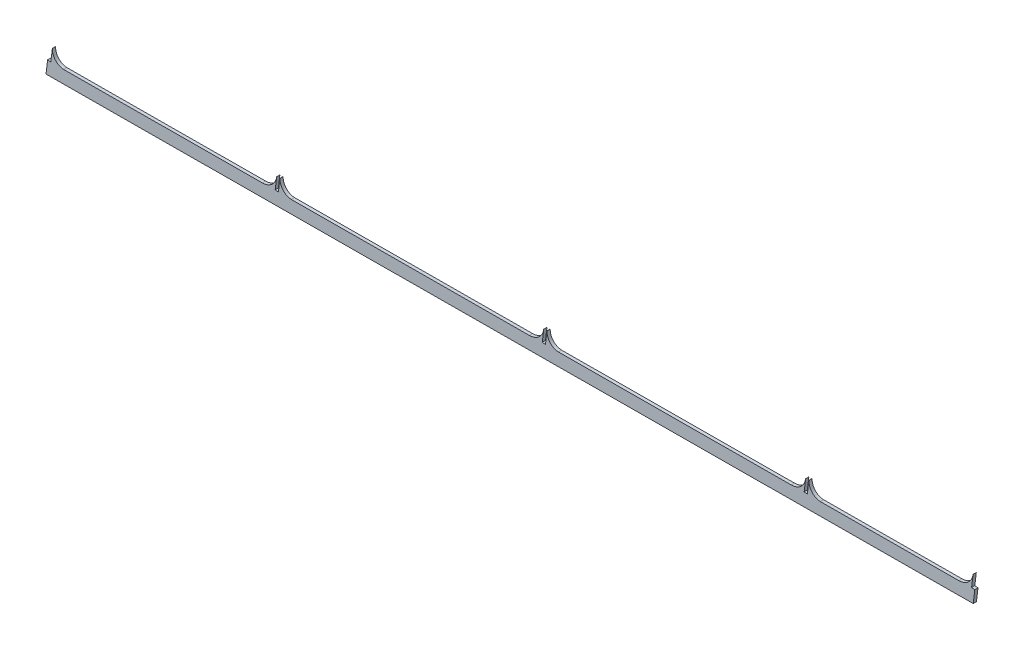
from build123d import *

# Parameters (mm, degrees)
EXTRUDE_1_DEPTH = 2


with BuildPart() as part:
    # Model → 凸台-拉伸1 (new body)
    with BuildSketch(Plane.XY):
        with BuildLine():
            Line((5.143788589, 18.04241923), (4.137613793, 9.847783121))
            Line((4.137613793, 9.847783121), (580.873096163, 12.99559552))
            Line((580.873096163, 12.99559552), (581.848050911, 20.935964733))
            Line((581.848050911, 20.935964733), (579.866676478, 21.179246923))
            Line((579.866676478, 21.179246923), (580.791756024, 28.713415216))
            ThreePointArc((580.791756024, 28.713415216), (577.819958349, 23.132995179), (571.91207976, 20.881409119))
            Line((571.91207976, 20.881409119), (485.690224553, 20.411136961))
            ThreePointArc((485.690224553, 20.411136961), (480.53763707, 22.90043185), (478.665298456, 28.307842962))
            Line((478.665298456, 28.307842962), (477.690343709, 20.367473749))
            Line((477.690343709, 20.367473749), (475.708969276, 20.610755938))
            Line((475.708969276, 20.610755938), (476.634048822, 28.144924232))
            ThreePointArc((476.634048822, 28.144924232), (473.633509712, 22.539262149), (467.677868383, 20.31282583))
            Line((467.677868383, 20.31282583), (322.805939428, 19.522117319))
            ThreePointArc((322.805939428, 19.522117319), (317.653351945, 22.011412208), (315.781013331, 27.418823319))
            Line((315.781013331, 27.418823319), (314.806058584, 19.478454106))
            Line((314.806058584, 19.478454106), (312.824684151, 19.721736296))
            Line((312.824684151, 19.721736296), (313.749763697, 27.25590459))
            ThreePointArc((313.749763697, 27.25590459), (310.749224588, 21.650242507), (304.793583258, 19.423806187))
            Line((304.793583258, 19.423806187), (156.683570496, 18.615424271))
            ThreePointArc((156.683570496, 18.615424271), (151.530983012, 21.104719159), (149.658644399, 26.512130271))
            Line((149.658644399, 26.512130271), (148.683689651, 18.571761058))
            Line((148.683689651, 18.571761058), (146.702315218, 18.815043248))
            Line((146.702315218, 18.815043248), (147.627394764, 26.349211541))
            ThreePointArc((147.627394764, 26.349211541), (144.626855655, 20.743549458), (138.671214325, 18.517113139))
            Line((138.671214325, 18.517113139), (15.125043867, 17.842800254))
            ThreePointArc((15.125043867, 17.842800254), (9.972456383, 20.332095142), (8.10011777, 25.739506254))
            Line((8.10011777, 25.739506254), (7.125163022, 17.799137041))
            Line((7.125163022, 17.799137041), (5.143788589, 18.04241923))
        make_face()
    extrude(amount=EXTRUDE_1_DEPTH)


solid = part.part
